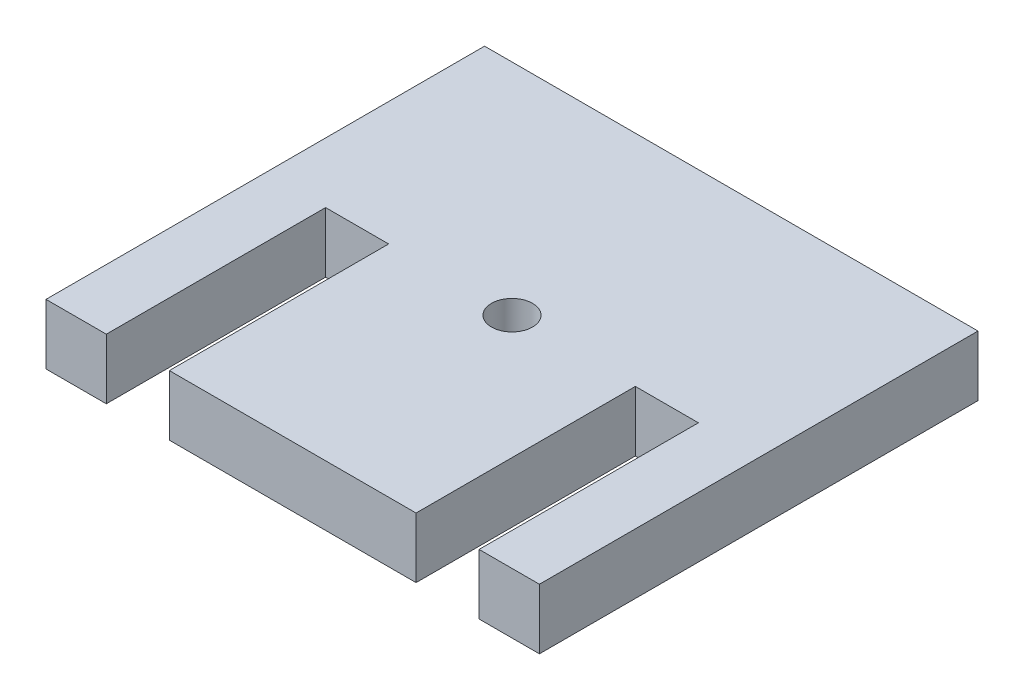
from build123d import *

# Parameters (mm, degrees)
SKETCH1_R           = 0.75
BOSS_EXTRUDE1_DEPTH = 2.2


with BuildPart() as part:
    # Sketch1 → Boss-Extrude1 (new body)
    with BuildSketch(Plane(origin=(0, 0, 0), x_dir=(1, 0, 0), z_dir=(0, 1, 0))):
        Polygon((65.492915323, 15.597712716), (65.492915323, -0.402287284), (63.292915323, -0.402287284), (63.292915323, 7.597712716), (60.992915323, 7.597712716), (60.992915323, -0.402287284), (51.992915323, -0.402287284), (51.992915323, 7.597712716), (49.692915323, 7.597712716), (49.692915323, -0.402287284), (47.492915323, -0.402287284), (47.492915323, 15.597712716), align=None)
        with Locations(Location((56.492915323, 7.597712716, 0), (0, 0, 270))):
            Circle(SKETCH1_R, mode=Mode.SUBTRACT)
    extrude(amount=BOSS_EXTRUDE1_DEPTH)


solid = part.part
